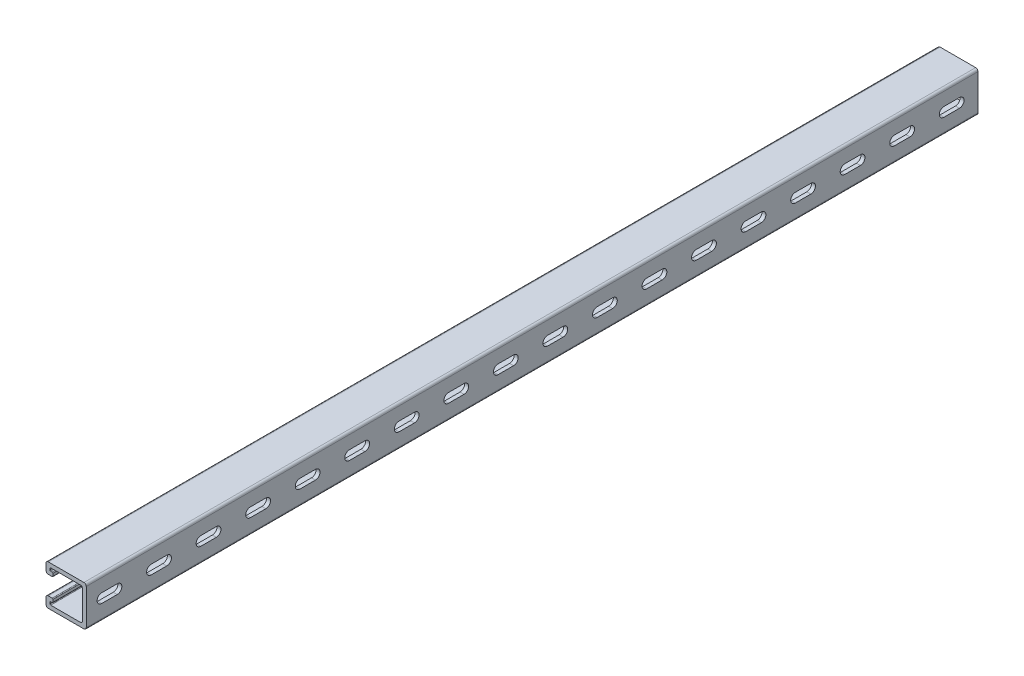
from build123d import *

# Parameters (mm, degrees)
EXTRUDE_THIN1_DEPTH = 914.4
FILLET2_R           = 0.762
FILLET3_R           = 1.524
CUT_EXTRUDE1_DEPTH  = 916.563701788
LPATTERN1_COUNT     = 18
LPATTERN1_PITCH     = 50.8


with BuildPart() as part:
    # Sketch1 → Extrude-Thin1 (new body)
    with BuildSketch(Plane.XY):
        with BuildLine():
            Line((-13.5255, 9.525), (-18.2499, 9.525))
            ThreePointArc((-18.2499, 9.525), (-19.938188151, 10.224311849), (-20.6375, 11.9126))
            Line((-20.6375, 11.9126), (-20.6375, 18.2499))
            ThreePointArc((-20.6375, 18.2499), (-19.938188151, 19.938188151), (-18.2499, 20.6375))
            Line((-18.2499, 20.6375), (18.2499, 20.6375))
            ThreePointArc((18.2499, 20.6375), (19.938188151, 19.938188151), (20.6375, 18.2499))
            Line((20.6375, 18.2499), (20.6375, -18.2499))
            ThreePointArc((20.6375, -18.2499), (19.938188151, -19.938188151), (18.2499, -20.6375))
            Line((18.2499, -20.6375), (-18.2499, -20.6375))
            ThreePointArc((-18.2499, -20.6375), (-19.938188151, -19.938188151), (-20.6375, -18.2499))
            Line((-20.6375, -18.2499), (-20.6375, -11.9126))
            ThreePointArc((-20.6375, -11.9126), (-19.938188151, -10.224311849), (-18.2499, -9.525))
            Line((-18.2499, -9.525), (-13.5255, -9.525))
            Line((-13.5255, -9.525), (-13.5255, -13.589))
            Line((-13.5255, -13.589), (-16.5735, -13.589))
            Line((-16.5735, -13.589), (-16.5735, -16.5735))
            Line((-16.5735, -16.5735), (16.5735, -16.5735))
            Line((16.5735, -16.5735), (16.5735, 16.5735))
            Line((16.5735, 16.5735), (-16.5735, 16.5735))
            Line((-16.5735, 16.5735), (-16.5735, 13.589))
            Line((-16.5735, 13.589), (-13.5255, 13.589))
            Line((-13.5255, 13.589), (-13.5255, 9.525))
        make_face()
    extrude(amount=-EXTRUDE_THIN1_DEPTH)

    # Fillet2
    fillet2_edges = [part.edges().sort_by_distance(p)[0] for p in [
        (-16.5735, -13.589, -457.2),
        (-16.5735, -16.5735, -457.2),
        (-16.5735, 16.5735, -457.2),
        (-16.5735, 13.589, -457.2),
        (-13.5255, 13.589, -457.2),
        (-13.5255, 9.525, -457.2),
        (-13.5255, -9.525, -457.2),
        (-13.5255, -13.589, -457.2),
    ]]
    fillet(fillet2_edges, radius=FILLET2_R)

    # Fillet3
    fillet3_edges = [part.edges().sort_by_distance(p)[0] for p in [
        (16.5735, -16.5735, -457.2),
        (16.5735, 16.5735, -457.2),
    ]]
    fillet(fillet3_edges, radius=FILLET3_R)

    # Sketch2 → Cut-Extrude1 (cut, through all)
    with BuildSketch(Plane(origin=(20.6375, 0, 0), x_dir=(0, 0, -1), z_dir=(1, 0, 0))):
        with BuildLine():
            Line((15.875, 4.7625), (31.75, 4.7625))
            ThreePointArc((31.75, 4.7625), (36.5125, 0), (31.75, -4.7625))
            Line((31.75, -4.7625), (15.875, -4.7625))
            ThreePointArc((15.875, -4.7625), (11.1125, 0), (15.875, 4.7625))
        make_face()
    cut_extrude1 = extrude(amount=-CUT_EXTRUDE1_DEPTH, mode=Mode.SUBTRACT)

    # LPattern1: Cut-Extrude1 ×18
    with Locations(*[(0, 0, -i * LPATTERN1_PITCH) for i in range(1, LPATTERN1_COUNT)]):
        add(cut_extrude1, mode=Mode.SUBTRACT)


solid = part.part
